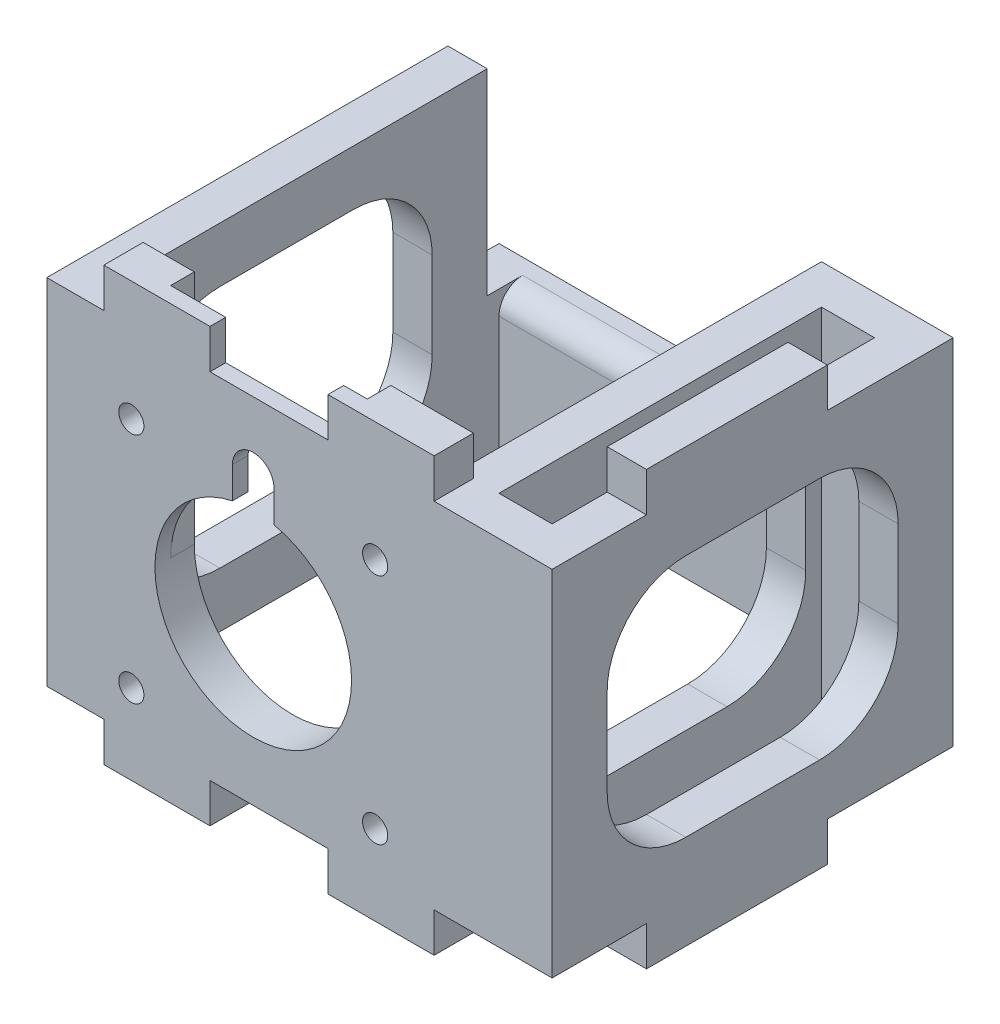
from build123d import *

# Parameters (mm, degrees)
ESQUISSE1_W                  = 52.5
ESQUISSE1_H                  = 57.5
ESQUISSE1_W_2                = 42.5
ESQUISSE1_H_2                = 47.5
EXTRU_MINCE1_DEPTH           = 20
ESQUISSE3_W                  = 6.75
ESQUISSE3_H                  = 41
ESQUISSE3_W_2                = 30.75
BOSS_EXTRU_1_DEPTH           = 45
ESQUISSE6_W                  = 5
ESQUISSE6_H                  = 23
ESQUISSE6_W_2                = 13.5
ESQUISSE6_H_2                = 5
BOSS_EXTRU_3_DEPTH           = 5
ENL_V_MAT_EXTRU_1_REACH      = 100.236
ESQUISSE2_R                  = 1.6
ENL_V_START                  = -3
ENL_V_MAT_EXTRU_2_DEPTH      = 3
CONG_1_R                     = 3
ENL_V_MAT_EXTRU_3_DEPTH      = 116.440731547
ENL_V_MAT_EXTRU_4_DEPTH      = 95.578010129
ENL_V_MAT_EXTRU_5_DEPTH      = 85.679173945
ENL_V_MAT_EXTRU_5_DEPTH_BACK = 85.679173945
ESQUISSE10_W                 = 35.75
ESQUISSE10_H                 = 51


with BuildPart() as part:
    # Esquisse1 → Extru.-Mince1 (new body)
    with BuildSketch(Plane(origin=(0, 0, 0), x_dir=(1, 0, 0), z_dir=(0, 1, 0))):
        Rectangle(ESQUISSE1_W, ESQUISSE1_H)
        Rectangle(ESQUISSE1_W_2, ESQUISSE1_H_2, mode=Mode.SUBTRACT)
    extrude(amount=EXTRU_MINCE1_DEPTH)

    # Esquisse3 → Boss.-Extru.1 (add)
    with BuildSketch(Plane.XZ):
        Polygon((26.25, 28.75), (38, 28.75), (38, -22.25), (21.25, -22.25), (21.25, 23.75), (-21.25, 23.75), (-21.25, -22.25), (-62, -22.25), (-62, 28.75), (-26.25, 28.75), (0, 28.75), align=None)
        with Locations((29.625, 3.25)):
            Rectangle(ESQUISSE3_W, ESQUISSE3_H, mode=Mode.SUBTRACT)
        with Locations((-41.625, 3.25)):
            Rectangle(ESQUISSE3_W_2, ESQUISSE3_H, mode=Mode.SUBTRACT)
    extrude(amount=-BOSS_EXTRU_1_DEPTH)

    # Esquisse6 → Boss.-Extru.3 (add)
    with BuildSketch(Plane(origin=(0, 45, 0), x_dir=(1, 0, 0), z_dir=(0, 1, 0))):
        with Locations((35.5, -5.25)):
            Rectangle(ESQUISSE6_W, ESQUISSE6_H)
        with Locations((16.25, -26.25)):
            Rectangle(ESQUISSE6_W_2, ESQUISSE6_H_2)
        with Locations((-12.25, -26.25)):
            Rectangle(ESQUISSE6_W_2, ESQUISSE6_H_2)
        with Locations((-40.75, -26.25)):
            Rectangle(ESQUISSE6_W_2, ESQUISSE6_H_2)
        with Locations((-40.75, 19.75)):
            Rectangle(ESQUISSE6_W_2, ESQUISSE6_H_2)
        with Locations((-59.5, -5.25)):
            Rectangle(ESQUISSE6_W, ESQUISSE6_H)
    boss_extru_3 = extrude(amount=BOSS_EXTRU_3_DEPTH)

    # Esquisse2 → Enlèv. mat.-Extru.1 (cut, up to next)
    with BuildSketch(Plane.XY.offset(28.75), mode=Mode.PRIVATE) as enl_v_mat_extru_1_sk1:
        with Locations((-15.5, 5.2)):
            Circle(ESQUISSE2_R)
    enl_v_mat_extru_1_tool1 = extrude(enl_v_mat_extru_1_sk1.sketch, amount=-ENL_V_MAT_EXTRU_1_REACH, mode=Mode.PRIVATE) & part.part
    # Esquisse2 → Enlèv. mat.-Extru.1 (cut, up to next)
    with BuildSketch(Plane.XY.offset(28.75), mode=Mode.PRIVATE) as enl_v_mat_extru_1_sk2:
        with Locations((15.5, 5.2)):
            Circle(ESQUISSE2_R)
    enl_v_mat_extru_1_tool2 = extrude(enl_v_mat_extru_1_sk2.sketch, amount=-ENL_V_MAT_EXTRU_1_REACH, mode=Mode.PRIVATE) & part.part
    # Esquisse2 → Enlèv. mat.-Extru.1 (cut, up to next)
    with BuildSketch(Plane.XY.offset(28.75), mode=Mode.PRIVATE) as enl_v_mat_extru_1_sk3:
        with Locations(Location((15.5, 34.8, 0), (0, 0, 180))):
            Circle(ESQUISSE2_R)
    enl_v_mat_extru_1_tool3 = extrude(enl_v_mat_extru_1_sk3.sketch, amount=-ENL_V_MAT_EXTRU_1_REACH, mode=Mode.PRIVATE) & part.part
    # Esquisse2 → Enlèv. mat.-Extru.1 (cut, up to next)
    with BuildSketch(Plane.XY.offset(28.75), mode=Mode.PRIVATE) as enl_v_mat_extru_1_sk4:
        with Locations(Location((-15.5, 34.8, 0), (0, 0, 180))):
            Circle(ESQUISSE2_R)
    enl_v_mat_extru_1_tool4 = extrude(enl_v_mat_extru_1_sk4.sketch, amount=-ENL_V_MAT_EXTRU_1_REACH, mode=Mode.PRIVATE) & part.part
    # Esquisse2 → Enlèv. mat.-Extru.1 (cut, up to next)
    with BuildSketch(Plane.XY.offset(28.75), mode=Mode.PRIVATE) as enl_v_mat_extru_1_sk5:
        with BuildLine():
            Line((2.65, 36.215870824), (2.65, 32.215870824))
            ThreePointArc((2.65, 32.215870824), (0, 7.5), (-2.65, 32.215870824))
            Line((-2.65, 32.215870824), (-2.65, 36.215870824))
            ThreePointArc((-2.65, 36.215870824), (0, 38.865870824), (2.65, 36.215870824))
        make_face()
    enl_v_mat_extru_1_tool5 = extrude(enl_v_mat_extru_1_sk5.sketch, amount=-ENL_V_MAT_EXTRU_1_REACH, mode=Mode.PRIVATE) & part.part
    add(enl_v_mat_extru_1_tool1.solids().sort_by_distance((-15.5, 5.2, 28.75))[0], mode=Mode.SUBTRACT)
    add(enl_v_mat_extru_1_tool2.solids().sort_by_distance((15.5, 5.2, 28.75))[0], mode=Mode.SUBTRACT)
    add(enl_v_mat_extru_1_tool3.solids().sort_by_distance((15.5, 34.8, 28.75))[0], mode=Mode.SUBTRACT)
    add(enl_v_mat_extru_1_tool4.solids().sort_by_distance((-15.5, 34.8, 28.75))[0], mode=Mode.SUBTRACT)
    add(enl_v_mat_extru_1_tool5.solids().sort_by_distance((0, 20.91985, 28.75))[0], mode=Mode.SUBTRACT)

    # Esquisse4 → Enlèv. mat.-Extru.2 (cut)
    with BuildSketch(Plane(origin=(0, 0, 23.75), x_dir=(-1, 0, 0), z_dir=(0, 0, -1)).offset(ENL_V_START)):
        with BuildLine():
            Line((-12.5, 20), (-12.5, 50))
            Line((-12.5, 50), (12.5, 50))
            Line((12.5, 50), (12.5, 20))
            ThreePointArc((12.5, 20), (0, 32.5), (-12.5, 20))
        make_face()
    extrude(amount=ENL_V_MAT_EXTRU_2_DEPTH, mode=Mode.SUBTRACT)

    # Symétrie1: Boss.-Extru.3 across plane
    add(boss_extru_3.mirror(Plane(origin=(0, 22.5, 0), x_dir=(0, 0, 1), z_dir=(0, -1, 0))))

    # Congé1
    cong_1_edges = [part.edges().sort_by_distance(p)[0] for p in [
        (0, 20, -23.75),
    ]]
    fillet(cong_1_edges, radius=CONG_1_R)

    # Esquisse7 → Enlèv. mat.-Extru.3 (cut, through all)
    with BuildSketch(Plane(origin=(38, 0, 0), x_dir=(0, 0, -1), z_dir=(1, 0, 0))):
        with BuildLine():
            Line((-11.75, 38), (5.25, 38))
            ThreePointArc((5.25, 38), (12.321067812, 35.071067812), (15.25, 28))
            Line((15.25, 28), (15.25, 17))
            ThreePointArc((15.25, 17), (12.321067812, 9.928932188), (5.25, 7))
            Line((5.25, 7), (-11.75, 7))
            ThreePointArc((-11.75, 7), (-18.821067812, 9.928932188), (-21.75, 17))
            Line((-21.75, 17), (-21.75, 28))
            ThreePointArc((-21.75, 28), (-18.821067812, 35.071067812), (-11.75, 38))
        make_face()
    extrude(amount=-ENL_V_MAT_EXTRU_3_DEPTH, mode=Mode.SUBTRACT)

    # Esquisse8 → Enlèv. mat.-Extru.4 (cut, through all)
    with BuildSketch(Plane(origin=(0, 0, -22.25), x_dir=(-1, 0, 0), z_dir=(0, 0, -1))):
        with BuildLine():
            Line((48.625, 30), (48.625, 15))
            ThreePointArc((48.625, 15), (41.625, 8), (34.625, 15))
            Line((34.625, 15), (34.625, 30))
            ThreePointArc((34.625, 30), (41.625, 37), (48.625, 30))
        make_face()
    extrude(amount=-ENL_V_MAT_EXTRU_4_DEPTH, mode=Mode.SUBTRACT)

    # Esquisse10 → Enlèv. mat.-Extru.5 (cut, two sides: drawn at the far end of the back side and taken through both)
    with BuildSketch(Plane(origin=(0, 45, 0), x_dir=(1, 0, 0), z_dir=(0, 1, 0)).offset(-ENL_V_MAT_EXTRU_5_DEPTH_BACK)):
        with Locations((-44.125, -3.25)):
            Rectangle(ESQUISSE10_W, ESQUISSE10_H)
    extrude(amount=ENL_V_MAT_EXTRU_5_DEPTH + ENL_V_MAT_EXTRU_5_DEPTH_BACK, mode=Mode.SUBTRACT)


solid = part.part
